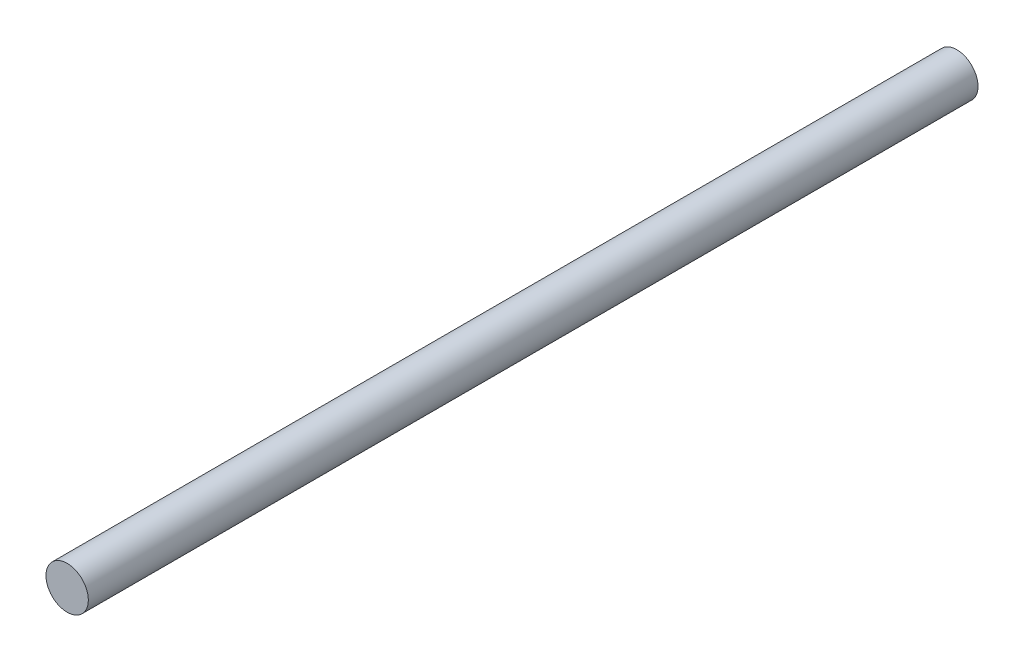
from build123d import *

# Parameters (mm, degrees)
SKETCH_1_R      = 2.5
EXTRUDE_1_DEPTH = 105


with BuildPart() as part:
    # Эскиз1 → Вытянуть1 (new body)
    with BuildSketch(Plane.XY):
        Circle(SKETCH_1_R)
    extrude(amount=EXTRUDE_1_DEPTH)


solid = part.part
